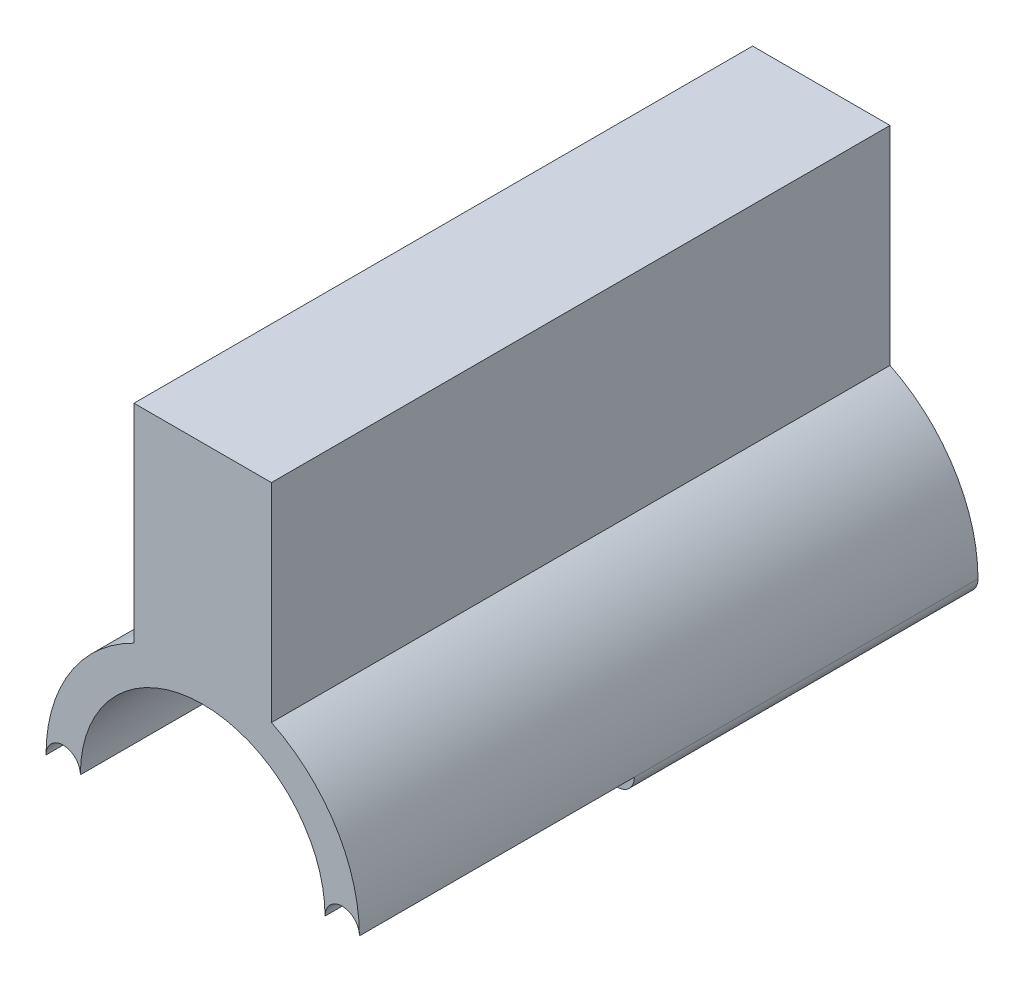
from build123d import *

# Parameters (mm, degrees)
BOSS_EXTRU_1_DEPTH      = 450
ESQUISSE2_R             = 7.5
ENL_V_MAT_EXTRU_1_DEPTH = 350
ESQUISSE2_3_R           = 12.5
ESQUISSE2_3_R_2         = 7.5
ENL_V_MAT_EXTRU_2_DEPTH = 200


with BuildPart() as part:
    # Esquisse1 → Boss.-Extru.1 (new body)
    with BuildSketch(Plane.XY):
        with BuildLine():
            ThreePointArc((-89, 0), (0, 89), (89, 0))
            ThreePointArc((89, 0), (101.5, -12.5), (114, 0))
            ThreePointArc((114, 0), (96.685055722, 60.398675482), (50, 102.449987799))
            Line((50, 102.449987799), (50, 253.627440537))
            Line((50, 253.627440537), (-50, 253.627440537))
            Line((-50, 253.627440537), (-50, 102.449987799))
            ThreePointArc((-50, 102.449987799), (-96.685055722, 60.398675482), (-114, 0))
            ThreePointArc((-114, 0), (-101.5, -12.5), (-89, 0))
        make_face()
    extrude(amount=BOSS_EXTRU_1_DEPTH)

    # Esquisse2 → Enlèv. mat.-Extru.1 (cut)
    with BuildSketch(Plane.XY.offset(450)):
        with Locations((101.5, 0)):
            Circle(ESQUISSE2_R)
        with Locations((-101.5, 0)):
            Circle(ESQUISSE2_R)
    extrude(amount=-ENL_V_MAT_EXTRU_1_DEPTH, mode=Mode.SUBTRACT)

    # Esquisse2<3> → Enlèv. mat.-Extru.2 (cut)
    # profile 1 of 2: a face of its own
    with BuildSketch(Plane.XY.offset(450)):
        with Locations((-101.5, 0)):
            Circle(ESQUISSE2_3_R)
        with Locations((-101.5, 0)):
            Circle(ESQUISSE2_3_R_2, mode=Mode.SUBTRACT)
    # profile 2 of 2: a face of its own
    with BuildSketch(Plane.XY.offset(450)):
        with Locations((101.5, 0)):
            Circle(ESQUISSE2_3_R)
        with Locations((101.5, 0)):
            Circle(ESQUISSE2_3_R_2, mode=Mode.SUBTRACT)
    extrude(amount=-ENL_V_MAT_EXTRU_2_DEPTH, mode=Mode.SUBTRACT)


solid = part.part
